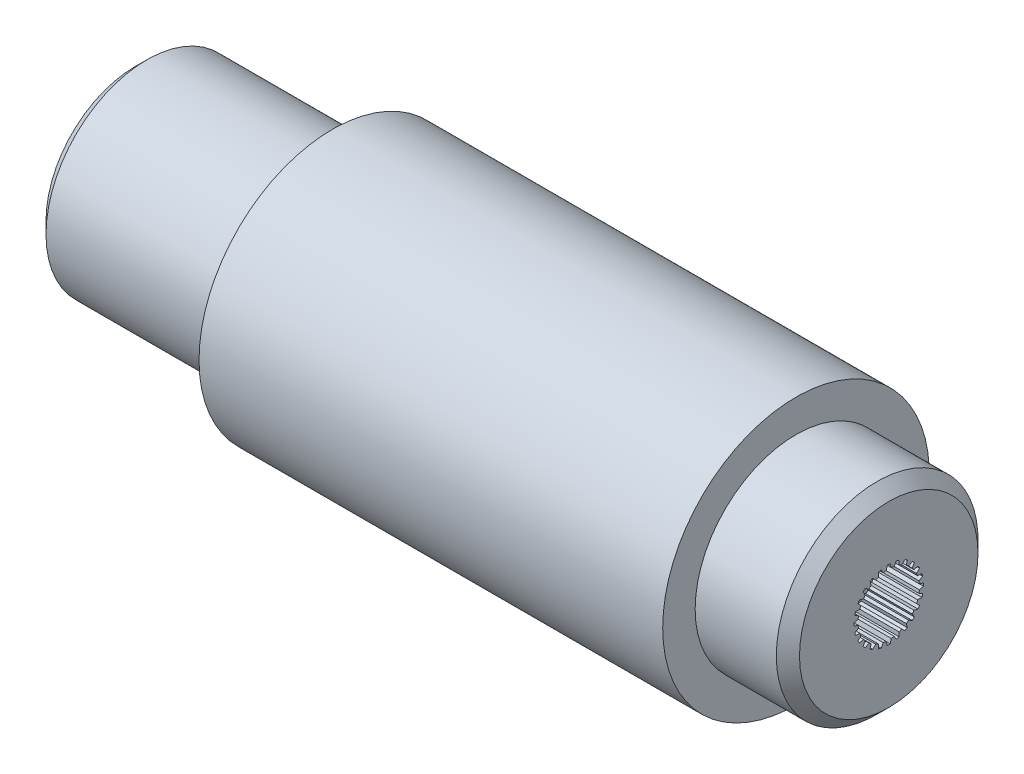
from build123d import *

# Parameters (mm, degrees)
CUT_EXTRUDE_1_DEPTH = 4


with BuildPart() as part:
    # Эскиз3 → Повернуть1 (revolve)
    with BuildSketch(Plane.XY, mode=Mode.PRIVATE) as revolve_1_sk:
        Polygon((-7, 4.25), (-7, 7.7), (-6, 8.7), (10, 8.7), (10, 11.5), (50, 11.5), (50, 8.7), (57, 8.7), (58, 7.7), (58, 0), (52.453738644, 0), (50, 4.25), align=None)
    revolve(revolve_1_sk.sketch.rotate(Axis((-6.877569373, 0, 0), (1, 0, 0)), 90), axis=Axis((-6.877569373, 0, 0), (1, 0, 0)))

    # Эскиз4 → Вырез-Вытянуть1 (cut)
    with BuildSketch(Plane(origin=(58, 0, -31), x_dir=(0, 0, 1), z_dir=(-1, 0, 0))):
        with BuildLine():
            Line((30.778386531, 2.640717227), (30.875027145, 2.996524002))
            ThreePointArc((30.875027145, 2.996524002), (31, 2.999128925), (31.124972855, 2.996524002))
            Line((31.124972855, 2.996524002), (31.221613469, 2.640717227))
            ThreePointArc((31.221613469, 2.640717227), (31.345894409, 2.627328883), (31.469405738, 2.608094755))
            Line((31.469405738, 2.608094755), (31.654842973, 2.926765277))
            ThreePointArc((31.654842973, 2.926765277), (31.776231684, 2.896936085), (31.896271989, 2.862074568))
            Line((31.896271989, 2.862074568), (31.897530084, 2.493379183))
            ThreePointArc((31.897530084, 2.493379183), (32.014111096, 2.448280761), (32.12843572, 2.397734937))
            Line((32.12843572, 2.397734937), (32.390032334, 2.657552336))
            ThreePointArc((32.390032334, 2.657552336), (32.499564462, 2.597321838), (32.606491668, 2.532579481))
            Line((32.606491668, 2.532579481), (32.512281507, 2.176121468))
            ThreePointArc((32.512281507, 2.176121468), (32.613217787, 2.102386352), (32.710564672, 2.023973445))
            Line((32.710564672, 2.023973445), (33.030493289, 2.207231595))
            ThreePointArc((33.030493289, 2.207231595), (33.1207044, 2.1207044), (33.207231595, 2.030493289))
            Line((33.207231595, 2.030493289), (33.023973445, 1.710564672))
            ThreePointArc((33.023973445, 1.710564672), (33.102386352, 1.613217787), (33.176121468, 1.512281507))
            Line((33.176121468, 1.512281507), (33.532579481, 1.606491668))
            ThreePointArc((33.532579481, 1.606491668), (33.597321838, 1.499564462), (33.657552336, 1.390032334))
            Line((33.657552336, 1.390032334), (33.397734937, 1.12843572))
            ThreePointArc((33.397734937, 1.12843572), (33.448280761, 1.014111096), (33.493379183, 0.897530084))
            Line((33.493379183, 0.897530084), (33.862074568, 0.896271989))
            ThreePointArc((33.862074568, 0.896271989), (33.896936085, 0.776231684), (33.926765277, 0.654842973))
            Line((33.926765277, 0.654842973), (33.608094755, 0.469405738))
            ThreePointArc((33.608094755, 0.469405738), (33.627328883, 0.345894409), (33.640717227, 0.221613469))
            Line((33.640717227, 0.221613469), (33.996524002, 0.124972855))
            ThreePointArc((33.996524002, 0.124972855), (33.999128925, 0), (33.996524002, -0.124972855))
            Line((33.996524002, -0.124972855), (33.640717227, -0.221613469))
            ThreePointArc((33.640717227, -0.221613469), (33.627328883, -0.345894409), (33.608094755, -0.469405738))
            Line((33.608094755, -0.469405738), (33.926765277, -0.654842973))
            ThreePointArc((33.926765277, -0.654842973), (33.896936085, -0.776231684), (33.862074568, -0.896271989))
            Line((33.862074568, -0.896271989), (33.493379183, -0.897530084))
            ThreePointArc((33.493379183, -0.897530084), (33.448280761, -1.014111096), (33.397734937, -1.12843572))
            Line((33.397734937, -1.12843572), (33.657552336, -1.390032334))
            ThreePointArc((33.657552336, -1.390032334), (33.597321838, -1.499564462), (33.532579481, -1.606491668))
            Line((33.532579481, -1.606491668), (33.176121468, -1.512281507))
            ThreePointArc((33.176121468, -1.512281507), (33.102386352, -1.613217787), (33.023973445, -1.710564672))
            Line((33.023973445, -1.710564672), (33.207231595, -2.030493289))
            ThreePointArc((33.207231595, -2.030493289), (33.1207044, -2.1207044), (33.030493289, -2.207231595))
            Line((33.030493289, -2.207231595), (32.710564672, -2.023973445))
            ThreePointArc((32.710564672, -2.023973445), (32.613217787, -2.102386352), (32.512281507, -2.176121468))
            Line((32.512281507, -2.176121468), (32.606491668, -2.532579481))
            ThreePointArc((32.606491668, -2.532579481), (32.499564462, -2.597321838), (32.390032334, -2.657552336))
            Line((32.390032334, -2.657552336), (32.12843572, -2.397734937))
            ThreePointArc((32.12843572, -2.397734937), (32.014111096, -2.448280761), (31.897530084, -2.493379183))
            Line((31.897530084, -2.493379183), (31.896271989, -2.862074568))
            ThreePointArc((31.896271989, -2.862074568), (31.776231684, -2.896936085), (31.654842973, -2.926765277))
            Line((31.654842973, -2.926765277), (31.469405738, -2.608094755))
            ThreePointArc((31.469405738, -2.608094755), (31.345894409, -2.627328883), (31.221613469, -2.640717227))
            Line((31.221613469, -2.640717227), (31.124972855, -2.996524002))
            ThreePointArc((31.124972855, -2.996524002), (31, -2.999128925), (30.875027145, -2.996524002))
            Line((30.875027145, -2.996524002), (30.778386531, -2.640717227))
            ThreePointArc((30.778386531, -2.640717227), (30.654105591, -2.627328883), (30.530594262, -2.608094755))
            Line((30.530594262, -2.608094755), (30.345157027, -2.926765277))
            ThreePointArc((30.345157027, -2.926765277), (30.223768316, -2.896936085), (30.103728011, -2.862074568))
            Line((30.103728011, -2.862074568), (30.102469916, -2.493379183))
            ThreePointArc((30.102469916, -2.493379183), (29.985888904, -2.448280761), (29.87156428, -2.397734937))
            Line((29.87156428, -2.397734937), (29.609967666, -2.657552336))
            ThreePointArc((29.609967666, -2.657552336), (29.500435538, -2.597321838), (29.393508332, -2.532579481))
            Line((29.393508332, -2.532579481), (29.487718493, -2.176121468))
            ThreePointArc((29.487718493, -2.176121468), (29.386782213, -2.102386352), (29.289435328, -2.023973445))
            Line((29.289435328, -2.023973445), (28.969506711, -2.207231595))
            ThreePointArc((28.969506711, -2.207231595), (28.8792956, -2.1207044), (28.792768405, -2.030493289))
            Line((28.792768405, -2.030493289), (28.976026555, -1.710564672))
            ThreePointArc((28.976026555, -1.710564672), (28.897613648, -1.613217787), (28.823878532, -1.512281507))
            Line((28.823878532, -1.512281507), (28.467420519, -1.606491668))
            ThreePointArc((28.467420519, -1.606491668), (28.402678162, -1.499564462), (28.342447664, -1.390032334))
            Line((28.342447664, -1.390032334), (28.602265063, -1.12843572))
            ThreePointArc((28.602265063, -1.12843572), (28.551719239, -1.014111096), (28.506620817, -0.897530084))
            Line((28.506620817, -0.897530084), (28.137925432, -0.896271989))
            ThreePointArc((28.137925432, -0.896271989), (28.103063915, -0.776231684), (28.073234723, -0.654842973))
            Line((28.073234723, -0.654842973), (28.391905245, -0.469405738))
            ThreePointArc((28.391905245, -0.469405738), (28.372671117, -0.345894409), (28.359282773, -0.221613469))
            Line((28.359282773, -0.221613469), (28.003475998, -0.124972855))
            ThreePointArc((28.003475998, -0.124972855), (28.000871075, 0), (28.003475998, 0.124972855))
            Line((28.003475998, 0.124972855), (28.359282773, 0.221613469))
            ThreePointArc((28.359282773, 0.221613469), (28.372671117, 0.345894409), (28.391905245, 0.469405738))
            Line((28.391905245, 0.469405738), (28.073234723, 0.654842973))
            ThreePointArc((28.073234723, 0.654842973), (28.103063915, 0.776231684), (28.137925432, 0.896271989))
            Line((28.137925432, 0.896271989), (28.506620817, 0.897530084))
            ThreePointArc((28.506620817, 0.897530084), (28.551719239, 1.014111096), (28.602265063, 1.12843572))
            Line((28.602265063, 1.12843572), (28.342447664, 1.390032334))
            ThreePointArc((28.342447664, 1.390032334), (28.402678162, 1.499564462), (28.467420519, 1.606491668))
            Line((28.467420519, 1.606491668), (28.823878532, 1.512281507))
            ThreePointArc((28.823878532, 1.512281507), (28.897613648, 1.613217787), (28.976026555, 1.710564672))
            Line((28.976026555, 1.710564672), (28.792768405, 2.030493289))
            ThreePointArc((28.792768405, 2.030493289), (28.8792956, 2.1207044), (28.969506711, 2.207231595))
            Line((28.969506711, 2.207231595), (29.289435328, 2.023973445))
            ThreePointArc((29.289435328, 2.023973445), (29.386782213, 2.102386352), (29.487718493, 2.176121468))
            Line((29.487718493, 2.176121468), (29.393508332, 2.532579481))
            ThreePointArc((29.393508332, 2.532579481), (29.500435538, 2.597321838), (29.609967666, 2.657552336))
            Line((29.609967666, 2.657552336), (29.87156428, 2.397734937))
            ThreePointArc((29.87156428, 2.397734937), (29.985888904, 2.448280761), (30.102469916, 2.493379183))
            Line((30.102469916, 2.493379183), (30.103728011, 2.862074568))
            ThreePointArc((30.103728011, 2.862074568), (30.223768316, 2.896936085), (30.345157027, 2.926765277))
            Line((30.345157027, 2.926765277), (30.530594262, 2.608094755))
            ThreePointArc((30.530594262, 2.608094755), (30.654105591, 2.627328883), (30.778386531, 2.640717227))
        make_face()
    extrude(amount=CUT_EXTRUDE_1_DEPTH, mode=Mode.SUBTRACT)


solid = part.part
